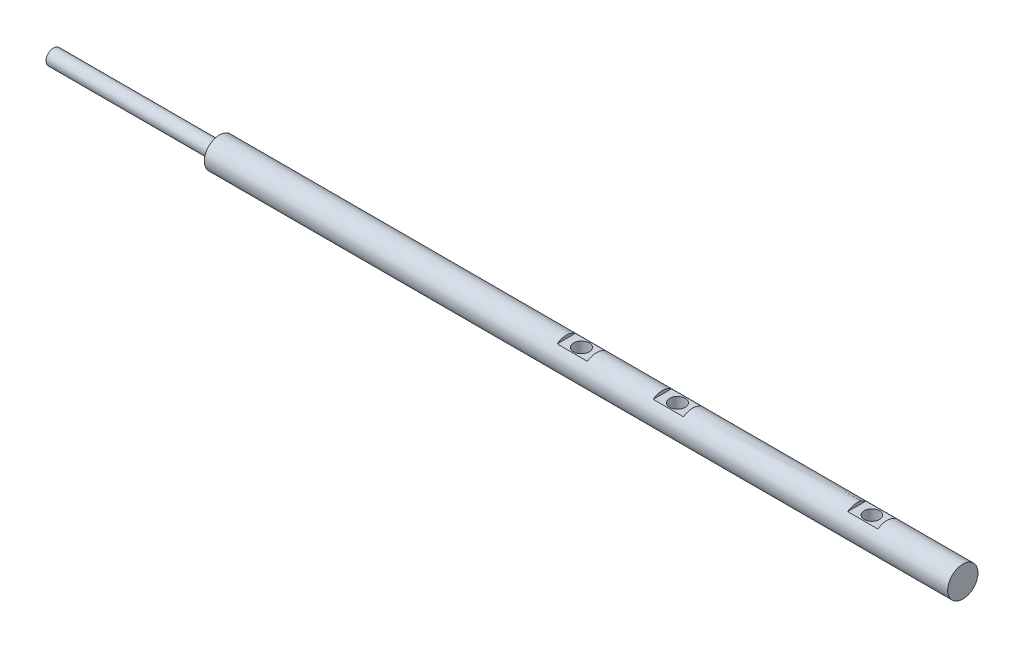
from build123d import *

# Parameters (mm, degrees)
SKETCH2_R                        = 3.175
MAIN_SHAFT_DEPTH                 = 95.25
PIN_HOLES_CUT_DEPTH              = 96.355774602
PIN_HOLES_CUT_DEPTH_BACK         = 96.355774602
SKETCH3_R                        = 1.63195
FLAT_FOR_DRILLING_CUT_DEPTH      = 96.355774709
FLAT_FOR_DRILLING_CUT_DEPTH_BACK = 96.355774709
SKETCH5_W                        = 6.35
SKETCH5_H                        = 0.635
F_1_8_CUT_DEPTH                  = 191.552909422
F_1_8_CUT_DEPTH_BACK             = 34.75482
SKETCH6_R                        = 3.175
SKETCH6_R_2                      = 1.5875
CUT_EXTRUDE1_DEPTH               = 96.355774709
CUT_EXTRUDE1_DEPTH_BACK          = 96.355774709
SKETCH7_R                        = 1.6
CUT_EXTRUDE2_START               = 2.54
SKETCH7_3_W                      = 6.35
SKETCH7_3_H                      = 13.17395124
SKETCH7_3_R                      = 1.6
CUT_EXTRUDE2_DEPTH               = 93.815774709


with BuildPart() as part:
    # Sketch2 → Main Shaft (new, symmetric)
    with BuildSketch(Plane(origin=(0, 0, 0), x_dir=(0, 0, -1), z_dir=(1, 0, 0))):
        Circle(SKETCH2_R)
    extrude(amount=MAIN_SHAFT_DEPTH, both=True)

    # Sketch3 → Pin Holes Cut (cut, two sides: drawn at the far end of the back side and taken through both)
    with BuildSketch(Plane(origin=(0, 0, 0), x_dir=(1, 0, 0), z_dir=(0, 1, 0)).offset(-PIN_HOLES_CUT_DEPTH_BACK)):
        with Locations((15.3416, 0)):
            Circle(SKETCH3_R)
        with Locations((35.4584, 0)):
            Circle(SKETCH3_R)
    extrude(amount=PIN_HOLES_CUT_DEPTH + PIN_HOLES_CUT_DEPTH_BACK, mode=Mode.SUBTRACT)

    # Sketch5 → Flat for drilling Cut (cut, two sides: drawn at the far end of the back side and taken through both)
    with BuildSketch(Plane.XY.offset(-FLAT_FOR_DRILLING_CUT_DEPTH_BACK)):
        with Locations((15.3416, 2.8575)):
            Rectangle(SKETCH5_W, SKETCH5_H)
        with Locations((35.45832639, 2.8575)):
            Rectangle(SKETCH5_W, SKETCH5_H)
    extrude(amount=FLAT_FOR_DRILLING_CUT_DEPTH + FLAT_FOR_DRILLING_CUT_DEPTH_BACK, mode=Mode.SUBTRACT)

    # Sketch6 → 1/8 Cut (cut, two sides: drawn at the far end of the back side and taken through both)
    with BuildSketch(Plane.ZY.offset(95.25).offset(-F_1_8_CUT_DEPTH_BACK)):
        Circle(SKETCH6_R)
        Circle(SKETCH6_R_2, mode=Mode.SUBTRACT)
    extrude(amount=F_1_8_CUT_DEPTH + F_1_8_CUT_DEPTH_BACK, mode=Mode.SUBTRACT)

    # Sketch7 → Cut-Extrude1 (cut, two sides: drawn at the far end of the back side and taken through both)
    with BuildSketch(Plane(origin=(0, 0, 0), x_dir=(1, 0, 0), z_dir=(0, 1, 0)).offset(-CUT_EXTRUDE1_DEPTH_BACK)):
        with Locations((76.2, 0)):
            Circle(SKETCH7_R)
    extrude(amount=CUT_EXTRUDE1_DEPTH + CUT_EXTRUDE1_DEPTH_BACK, mode=Mode.SUBTRACT)

    # Sketch7<3> → Cut-Extrude2 (cut, through all)
    with BuildSketch(Plane(origin=(0, 0, 0), x_dir=(1, 0, 0), z_dir=(0, 1, 0)).offset(CUT_EXTRUDE2_START)):
        with Locations((76.2, 0)):
            Rectangle(SKETCH7_3_W, SKETCH7_3_H)
        with Locations((76.2, 0)):
            Circle(SKETCH7_3_R, mode=Mode.SUBTRACT)
    extrude(amount=CUT_EXTRUDE2_DEPTH, mode=Mode.SUBTRACT)


solid = part.part
